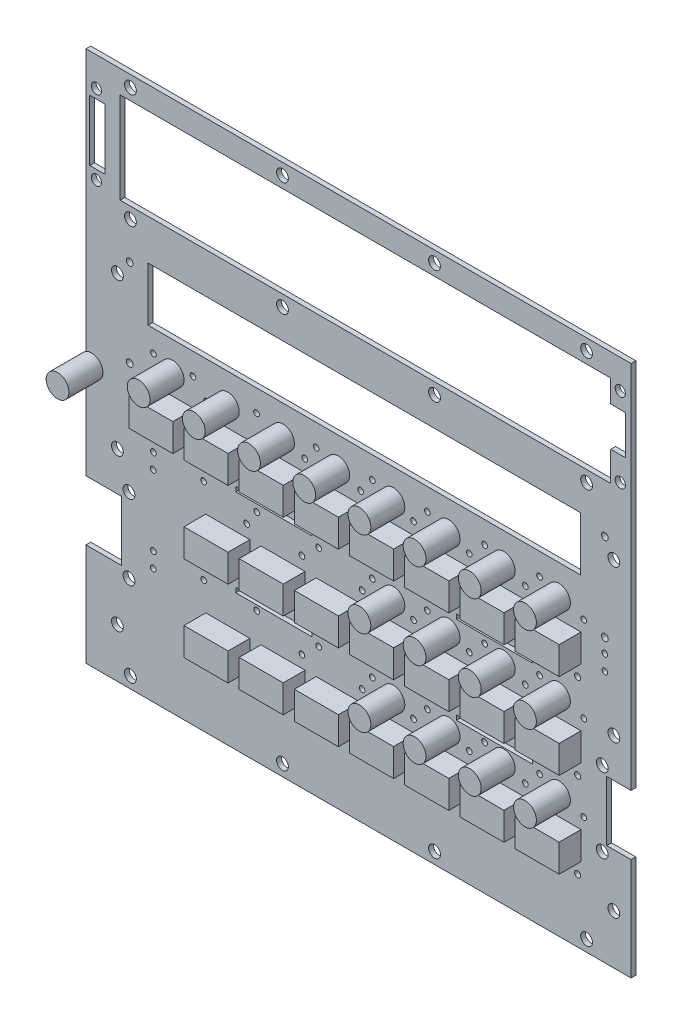
from build123d import *

# Parameters (mm, degrees)
SKETCH1_W                       = 144.56156
SKETCH1_H                       = 18.00098
SKETCH1_W_2                     = 5.08
SKETCH1_H_2                     = 20.32
SKETCH1_W_3                     = 25.4
SKETCH1_H_3                     = 1.5875
BOARD_DEPTH                     = 1.592072
SKETCH2_R                       = 3.81
LED_KINGBRIGHT_3P_2P54_1_DEPTH  = 11.3538
SKETCH3_R                       = 3.81
LED_KINGBRIGHT_3P_2P54_2_DEPTH  = 11.3538
SKETCH4_R                       = 3.81
LED_KINGBRIGHT_3P_2P54_3_DEPTH  = 11.3538
SKETCH5_R                       = 3.81
LED_KINGBRIGHT_3P_2P54_4_DEPTH  = 11.3538
SKETCH6_R                       = 3.81
LED_KINGBRIGHT_3P_2P54_5_DEPTH  = 11.3538
SKETCH7_R                       = 3.81
LED_KINGBRIGHT_3P_2P54_6_DEPTH  = 11.3538
SKETCH8_R                       = 3.81
LED_KINGBRIGHT_3P_2P54_7_DEPTH  = 11.3538
SKETCH9_R                       = 3.81
LED_KINGBRIGHT_3P_2P54_8_DEPTH  = 11.3538
SKETCH10_R                      = 3.81
LED_KINGBRIGHT_3P_2P54_9_DEPTH  = 11.3538
SKETCH19_R                      = 3.81
LED_KINGBRIGHT_3P_2P54_18_DEPTH = 11.3538
SKETCH20_R                      = 3.81
LED_KINGBRIGHT_3P_2P54_19_DEPTH = 11.3538
SKETCH21_R                      = 3.81
LED_KINGBRIGHT_3P_2P54_20_DEPTH = 11.3538
SKETCH22_R                      = 3.81
LED_KINGBRIGHT_3P_2P54_21_DEPTH = 11.3538
SKETCH23_R                      = 3.81
LED_KINGBRIGHT_3P_2P54_22_DEPTH = 11.3538
SKETCH24_R                      = 3.81
LED_KINGBRIGHT_3P_2P54_23_DEPTH = 11.3538
SKETCH25_R                      = 3.81
LED_KINGBRIGHT_3P_2P54_24_DEPTH = 11.3538
SKETCH26_R                      = 3.81
LED_KINGBRIGHT_3P_2P54_25_DEPTH = 11.3538
SKETCH27_W                      = 14.732
SKETCH27_H                      = 9.271
SWITCH_MCDTS2_1_DEPTH           = 7.3000108
SKETCH28_W                      = 14.732
SKETCH28_H                      = 9.271
SWITCH_MCDTS2_2_DEPTH           = 7.3000108
SKETCH29_W                      = 14.732
SKETCH29_H                      = 9.271
SWITCH_MCDTS2_3_DEPTH           = 7.3000108
SKETCH30_W                      = 14.732
SKETCH30_H                      = 9.271
SWITCH_MCDTS2_4_DEPTH           = 7.3000108
SKETCH31_W                      = 14.732
SKETCH31_H                      = 9.271
SWITCH_MCDTS2_5_DEPTH           = 7.3000108
SKETCH32_W                      = 14.732
SKETCH32_H                      = 9.271
SWITCH_MCDTS2_6_DEPTH           = 7.3000108
SKETCH33_W                      = 14.732
SKETCH33_H                      = 9.271
SWITCH_MCDTS2_7_DEPTH           = 7.3000108
SKETCH34_W                      = 14.732
SKETCH34_H                      = 9.271
SWITCH_MCDTS2_8_DEPTH           = 7.3000108
SKETCH36_W                      = 14.732
SKETCH36_H                      = 9.271
SWITCH_MCDTS2_10_DEPTH          = 7.3000108
SKETCH37_W                      = 14.732
SKETCH37_H                      = 9.271
SWITCH_MCDTS2_11_DEPTH          = 7.3000108
SKETCH38_W                      = 14.732
SKETCH38_H                      = 9.271
SWITCH_MCDTS2_12_DEPTH          = 7.3000108
SKETCH39_W                      = 14.732
SKETCH39_H                      = 9.271
SWITCH_MCDTS2_13_DEPTH          = 7.3000108
SKETCH40_W                      = 14.732
SKETCH40_H                      = 9.271
SWITCH_MCDTS2_14_DEPTH          = 7.3000108
SKETCH41_W                      = 14.732
SKETCH41_H                      = 9.271
SWITCH_MCDTS2_15_DEPTH          = 7.3000108
SKETCH43_W                      = 14.732
SKETCH43_H                      = 9.271
SWITCH_MCDTS2_17_DEPTH          = 7.3000108
SKETCH44_W                      = 14.732
SKETCH44_H                      = 9.271
SWITCH_MCDTS2_18_DEPTH          = 7.3000108
SKETCH45_W                      = 14.732
SKETCH45_H                      = 9.271
SWITCH_MCDTS2_19_DEPTH          = 7.3000108
SKETCH46_W                      = 14.732
SKETCH46_H                      = 9.271
SWITCH_MCDTS2_20_DEPTH          = 7.3000108
SKETCH47_W                      = 14.732
SKETCH47_H                      = 9.271
SWITCH_MCDTS2_21_DEPTH          = 7.3000108
SKETCH48_W                      = 14.732
SKETCH48_H                      = 9.271
SWITCH_MCDTS2_22_DEPTH          = 7.3000108
SKETCH49_W                      = 14.732
SKETCH49_H                      = 9.271
SWITCH_MCDTS2_23_DEPTH          = 7.3000108
SKETCH50_W                      = 14.732
SKETCH50_H                      = 9.271
SWITCH_MCDTS2_24_DEPTH          = 7.3000108
SKETCH52_R                      = 1.016
SKETCH52_R_2                    = 0.9652
SKETCH52_R_3                    = 0.9525
SKETCH52_R_4                    = 1.9685
SKETCH52_R_5                    = 1.1303
SKETCH52_R_6                    = 1.7145
CUT_EXTRUDE1_DEPTH              = 12.7


with BuildPart() as part:
    # Sketch1 → BOARD (new body)
    with BuildSketch(Plane.XY):
        Polygon((0, 0), (182.118, 0), (182.118, 34.24682), (173.98746, 34.24682), (173.98746, 54.24678), (182.118, 54.24678), (182.118, 177.8), (0, 177.8), (0, 54.24678), (11.86942, 54.24678), (11.86942, 34.24682), (0, 34.24682), align=None)
        with Locations((93.01988, 117.17909)):
            Rectangle(SKETCH1_W, SKETCH1_H, mode=Mode.SUBTRACT)
        with Locations((3.81, 154.813)):
            Rectangle(SKETCH1_W_2, SKETCH1_H_2, mode=Mode.SUBTRACT)
        Polygon((12.7, 170.18), (175.26, 170.18), (175.26, 162.6616), (180.086, 162.6616), (180.2892, 162.4584), (180.2892, 149.606), (175.3616, 149.606), (175.26, 149.5044), (175.26, 139.7), (12.7, 139.7), (11.43, 139.7), (11.43, 170.18), align=None, mode=Mode.SUBTRACT)
        with Locations((62.7634, 46.20895)):
            Rectangle(SKETCH1_W_3, SKETCH1_H_3, mode=Mode.SUBTRACT)
        with Locations((136.5134176, 46.20895)):
            Rectangle(SKETCH1_W_3, SKETCH1_H_3, mode=Mode.SUBTRACT)
        with Locations((136.5134176, 75.41895)):
            Rectangle(SKETCH1_W_3, SKETCH1_H_3, mode=Mode.SUBTRACT)
        with Locations((62.7634, 75.41895)):
            Rectangle(SKETCH1_W_3, SKETCH1_H_3, mode=Mode.SUBTRACT)
    extrude(amount=BOARD_DEPTH)

    # Sketch52 → Cut-Extrude1 (cut)
    with BuildSketch(Plane.XY.offset(1.592072)):
        with Locations((164.2745, 21.1074)):
            Circle(SKETCH52_R)
        with Locations((164.2745, 49.6824)):
            Circle(SKETCH52_R)
        with Locations((145.8341, 21.8186)):
            Circle(SKETCH52_R_2)
        with Locations((127.4191, 21.6154)):
            Circle(SKETCH52_R_2)
        with Locations((108.9787, 21.7424)):
            Circle(SKETCH52_R_2)
        with Locations((90.5383, 21.844)):
            Circle(SKETCH52_R_2)
        with Locations((72.0979, 20.7772)):
            Circle(SKETCH52_R_2)
        with Locations((53.6575, 21.1582)):
            Circle(SKETCH52_R_2)
        with Locations((35.2187002, 21.1328)):
            Circle(SKETCH52_R)
        with Locations((145.8341, 49.5554)):
            Circle(SKETCH52_R)
        with Locations((127.3937, 49.3522)):
            Circle(SKETCH52_R)
        with Locations((108.9533, 49.1236)):
            Circle(SKETCH52_R)
        with Locations((90.5129, 49.6824)):
            Circle(SKETCH52_R)
        with Locations((72.0725, 49.1998)):
            Circle(SKETCH52_R)
        with Locations((53.6321, 49.1998)):
            Circle(SKETCH52_R)
        with Locations((35.1917, 49.276)):
            Circle(SKETCH52_R)
        with Locations((164.2745, 78.2574)):
            Circle(SKETCH52_R)
        with Locations((145.8341, 77.7748)):
            Circle(SKETCH52_R)
        with Locations((127.3175, 78.3336)):
            Circle(SKETCH52_R)
        with Locations((108.9533, 78.74)):
            Circle(SKETCH52_R)
        with Locations((90.5129, 78.3336)):
            Circle(SKETCH52_R)
        with Locations((72.0725, 78.2574)):
            Circle(SKETCH52_R)
        with Locations((53.6321, 78.4098)):
            Circle(SKETCH52_R)
        with Locations((35.1917, 78.0542)):
            Circle(SKETCH52_R)
        with Locations((92.2655, 38.6588)):
            Circle(SKETCH52_R_3)
        with Locations((77.7367, 43.7388)):
            Circle(SKETCH52_R_3)
        with Locations((72.1487, 38.6588)):
            Circle(SKETCH52_R_3)
        with Locations((57.0611, 43.7388)):
            Circle(SKETCH52_R_3)
        with Locations((39.3065, 43.7388)):
            Circle(SKETCH52_R_3)
        with Locations((22.4663, 38.6588)):
            Circle(SKETCH52_R_3)
        with Locations((22.5425, 43.7388)):
            Circle(SKETCH52_R_3)
        with Locations((77.7367, 72.3138)):
            Circle(SKETCH52_R_3)
        with Locations((92.2655, 67.2338)):
            Circle(SKETCH52_R_3)
        with Locations((72.1487, 67.2338)):
            Circle(SKETCH52_R_3)
        with Locations((57.0611, 72.3138)):
            Circle(SKETCH52_R_3)
        with Locations((53.7083, 67.2338)):
            Circle(SKETCH52_R_3)
        with Locations((39.3065, 72.3138)):
            Circle(SKETCH52_R_3)
        with Locations((22.4663, 67.2338)):
            Circle(SKETCH52_R_3)
        with Locations((22.5425, 72.3138)):
            Circle(SKETCH52_R_3)
        with Locations((166.3065, 95.8088)):
            Circle(SKETCH52_R_3)
        with Locations((151.5491, 100.8888)):
            Circle(SKETCH52_R_3)
        with Locations((146.7993, 95.8088)):
            Circle(SKETCH52_R_3)
        with Locations((133.1849, 100.8888)):
            Circle(SKETCH52_R_3)
        with Locations((114.0587, 100.8888)):
            Circle(SKETCH52_R_3)
        with Locations((128.0795, 95.8088)):
            Circle(SKETCH52_R_3)
        with Locations((109.4359, 95.8088)):
            Circle(SKETCH52_R_3)
        with Locations((95.6691, 100.8888)):
            Circle(SKETCH52_R_3)
        with Locations((91.7575, 95.8088)):
            Circle(SKETCH52_R_3)
        with Locations((76.9493, 100.8888)):
            Circle(SKETCH52_R_3)
        with Locations((73.1139, 95.8088)):
            Circle(SKETCH52_R_3)
        with Locations((56.9849, 100.8888)):
            Circle(SKETCH52_R_3)
        with Locations((40.2971, 95.8088)):
            Circle(SKETCH52_R_3)
        with Locations((35.7505, 100.8888)):
            Circle(SKETCH52_R_3)
        with Locations((24.7777, 95.8088)):
            Circle(SKETCH52_R_3)
        with Locations((22.5425, 100.8888)):
            Circle(SKETCH52_R_3)
        with Locations((133.1849, 72.3138)):
            Circle(SKETCH52_R_3)
        with Locations((146.7993, 67.2338)):
            Circle(SKETCH52_R_3)
        with Locations((114.0587, 72.3138)):
            Circle(SKETCH52_R_3)
        with Locations((128.0795, 67.2338)):
            Circle(SKETCH52_R_3)
        with Locations((95.6691, 72.3138)):
            Circle(SKETCH52_R_3)
        with Locations((109.4359, 67.2338)):
            Circle(SKETCH52_R_3)
        with Locations((151.5491, 43.7388)):
            Circle(SKETCH52_R_3)
        with Locations((133.1849, 43.7388)):
            Circle(SKETCH52_R_3)
        with Locations((114.0587, 43.7388)):
            Circle(SKETCH52_R_3)
        with Locations((95.6691, 43.7388)):
            Circle(SKETCH52_R_3)
        with Locations((109.4359, 38.6588)):
            Circle(SKETCH52_R_3)
        with Locations((151.5491, 72.3138)):
            Circle(SKETCH52_R_3)
        with Locations((166.3065, 67.2338)):
            Circle(SKETCH52_R_3)
        with Locations((173.3296, 89.4588)):
            Circle(SKETCH52_R_3)
        with Locations((173.355, 84.3534)):
            Circle(SKETCH52_R_3)
        with Locations((176.37252, 118.11)):
            Circle(SKETCH52_R_4)
        with Locations((176.37252, 67.31)):
            Circle(SKETCH52_R_4)
        with Locations((176.37252, 16.51)):
            Circle(SKETCH52_R_4)
        with Locations((167.259, 135.89)):
            Circle(SKETCH52_R_4)
        with Locations((116.459, 135.89)):
            Circle(SKETCH52_R_4)
        with Locations((65.659, 135.89)):
            Circle(SKETCH52_R_4)
        with Locations((14.859, 135.89)):
            Circle(SKETCH52_R_4)
        with Locations((10.51052, 118.11)):
            Circle(SKETCH52_R_4)
        with Locations((10.51052, 67.31)):
            Circle(SKETCH52_R_4)
        with Locations((10.51052, 16.51)):
            Circle(SKETCH52_R_4)
        with Locations((166.3065, 38.6588)):
            Circle(SKETCH52_R_3)
        with Locations((146.7993, 38.6588)):
            Circle(SKETCH52_R_3)
        with Locations((128.0795, 38.6588)):
            Circle(SKETCH52_R_3)
        with Locations((14.859, 173.99)):
            Circle(SKETCH52_R_4)
        with Locations((65.659, 173.99)):
            Circle(SKETCH52_R_4)
        with Locations((116.459, 173.99)):
            Circle(SKETCH52_R_4)
        with Locations((167.259, 173.99)):
            Circle(SKETCH52_R_4)
        with Locations((167.259, 3.81)):
            Circle(SKETCH52_R_4)
        with Locations((116.459, 3.81)):
            Circle(SKETCH52_R_4)
        with Locations((65.659, 3.81)):
            Circle(SKETCH52_R_4)
        with Locations((14.859, 3.81)):
            Circle(SKETCH52_R_4)
        with Locations((172.50664, 56.7436)):
            Circle(SKETCH52_R_4)
        with Locations((172.50664, 31.75)):
            Circle(SKETCH52_R_4)
        with Locations((14.36878, 56.7436)):
            Circle(SKETCH52_R_4)
        with Locations((14.36878, 31.75)):
            Circle(SKETCH52_R_4)
        with Locations((173.35754, 123.37542)):
            Circle(SKETCH52_R_5)
        with Locations((173.35754, 94.16542)):
            Circle(SKETCH52_R_5)
        with Locations((14.60754, 94.16542)):
            Circle(SKETCH52_R_5)
        with Locations((14.60754, 123.37542)):
            Circle(SKETCH52_R_5)
        with Locations((178.51374, 141.56182)):
            Circle(SKETCH52_R_6)
        with Locations((178.51374, 168.06164)):
            Circle(SKETCH52_R_6)
        with Locations((3.50012, 168.06164)):
            Circle(SKETCH52_R_6)
        with Locations((3.50012, 141.56182)):
            Circle(SKETCH52_R_6)
    extrude(amount=-CUT_EXTRUDE1_DEPTH, mode=Mode.SUBTRACT)


with BuildPart() as body_2:
    # Sketch2 → LED-KINGBRIGHT_3P_2P54-1 (new body)
    with BuildSketch(Plane.XY.offset(1.592072)):
        with Locations((1.86944, 86.9188)):
            Circle(SKETCH2_R)
    extrude(amount=LED_KINGBRIGHT_3P_2P54_1_DEPTH)


with BuildPart() as body_3:
    # Sketch3 → LED-KINGBRIGHT_3P_2P54-2 (new body)
    with BuildSketch(Plane.XY.offset(1.592072)):
        with Locations((158.0312054, 41.1988)):
            Circle(SKETCH3_R)
    extrude(amount=LED_KINGBRIGHT_3P_2P54_2_DEPTH)


with BuildPart() as body_4:
    # Sketch4 → LED-KINGBRIGHT_3P_2P54-3 (new body)
    with BuildSketch(Plane.XY.offset(1.592072)):
        with Locations((139.593701, 41.1988)):
            Circle(SKETCH4_R)
    extrude(amount=LED_KINGBRIGHT_3P_2P54_3_DEPTH)


with BuildPart() as body_5:
    # Sketch5 → LED-KINGBRIGHT_3P_2P54-4 (new body)
    with BuildSketch(Plane.XY.offset(1.592072)):
        with Locations((121.1561966, 41.1988)):
            Circle(SKETCH5_R)
    extrude(amount=LED_KINGBRIGHT_3P_2P54_4_DEPTH)


with BuildPart() as body_6:
    # Sketch6 → LED-KINGBRIGHT_3P_2P54-5 (new body)
    with BuildSketch(Plane.XY.offset(1.592072)):
        with Locations((102.7187176, 41.1988)):
            Circle(SKETCH6_R)
    extrude(amount=LED_KINGBRIGHT_3P_2P54_5_DEPTH)


with BuildPart() as body_7:
    # Sketch7 → LED-KINGBRIGHT_3P_2P54-6 (new body)
    with BuildSketch(Plane.XY.offset(1.592072)):
        with Locations((158.0312308, 69.7738)):
            Circle(SKETCH7_R)
    extrude(amount=LED_KINGBRIGHT_3P_2P54_6_DEPTH)


with BuildPart() as body_8:
    # Sketch8 → LED-KINGBRIGHT_3P_2P54-7 (new body)
    with BuildSketch(Plane.XY.offset(1.592072)):
        with Locations((139.5937264, 69.7738)):
            Circle(SKETCH8_R)
    extrude(amount=LED_KINGBRIGHT_3P_2P54_7_DEPTH)


with BuildPart() as body_9:
    # Sketch9 → LED-KINGBRIGHT_3P_2P54-8 (new body)
    with BuildSketch(Plane.XY.offset(1.592072)):
        with Locations((121.156222, 69.7738)):
            Circle(SKETCH9_R)
    extrude(amount=LED_KINGBRIGHT_3P_2P54_8_DEPTH)


with BuildPart() as body_10:
    # Sketch10 → LED-KINGBRIGHT_3P_2P54-9 (new body)
    with BuildSketch(Plane.XY.offset(1.592072)):
        with Locations((102.7187176, 69.7738)):
            Circle(SKETCH10_R)
    extrude(amount=LED_KINGBRIGHT_3P_2P54_9_DEPTH)


with BuildPart() as body_11:
    # Sketch19 → LED-KINGBRIGHT_3P_2P54-18 (new body)
    with BuildSketch(Plane.XY.offset(1.592072)):
        with Locations((158.0312308, 98.3488)):
            Circle(SKETCH19_R)
    extrude(amount=LED_KINGBRIGHT_3P_2P54_18_DEPTH)


with BuildPart() as body_12:
    # Sketch20 → LED-KINGBRIGHT_3P_2P54-19 (new body)
    with BuildSketch(Plane.XY.offset(1.592072)):
        with Locations((139.5937264, 98.3488)):
            Circle(SKETCH20_R)
    extrude(amount=LED_KINGBRIGHT_3P_2P54_19_DEPTH)


with BuildPart() as body_13:
    # Sketch21 → LED-KINGBRIGHT_3P_2P54-20 (new body)
    with BuildSketch(Plane.XY.offset(1.592072)):
        with Locations((121.156222, 98.3488)):
            Circle(SKETCH21_R)
    extrude(amount=LED_KINGBRIGHT_3P_2P54_20_DEPTH)


with BuildPart() as body_14:
    # Sketch22 → LED-KINGBRIGHT_3P_2P54-21 (new body)
    with BuildSketch(Plane.XY.offset(1.592072)):
        with Locations((102.7187176, 98.3488)):
            Circle(SKETCH22_R)
    extrude(amount=LED_KINGBRIGHT_3P_2P54_21_DEPTH)


with BuildPart() as body_15:
    # Sketch23 → LED-KINGBRIGHT_3P_2P54-22 (new body)
    with BuildSketch(Plane.XY.offset(1.592072)):
        with Locations((84.2812132, 98.3488)):
            Circle(SKETCH23_R)
    extrude(amount=LED_KINGBRIGHT_3P_2P54_22_DEPTH)


with BuildPart() as body_16:
    # Sketch24 → LED-KINGBRIGHT_3P_2P54-23 (new body)
    with BuildSketch(Plane.XY.offset(1.592072)):
        with Locations((65.8437088, 98.3488)):
            Circle(SKETCH24_R)
    extrude(amount=LED_KINGBRIGHT_3P_2P54_23_DEPTH)


with BuildPart() as body_17:
    # Sketch25 → LED-KINGBRIGHT_3P_2P54-24 (new body)
    with BuildSketch(Plane.XY.offset(1.592072)):
        with Locations((47.4062044, 98.3488)):
            Circle(SKETCH25_R)
    extrude(amount=LED_KINGBRIGHT_3P_2P54_24_DEPTH)


with BuildPart() as body_18:
    # Sketch26 → LED-KINGBRIGHT_3P_2P54-25 (new body)
    with BuildSketch(Plane.XY.offset(1.592072)):
        with Locations((28.9687, 98.3488)):
            Circle(SKETCH26_R)
    extrude(amount=LED_KINGBRIGHT_3P_2P54_25_DEPTH)


with BuildPart() as body_19:
    # Sketch27 → SWITCH-MCDTS2-1 (new body)
    with BuildSketch(Plane.XY.offset(1.592072)):
        with Locations((158.0312308, 29.9593)):
            Rectangle(SKETCH27_W, SKETCH27_H)
    extrude(amount=SWITCH_MCDTS2_1_DEPTH)


with BuildPart() as body_20:
    # Sketch28 → SWITCH-MCDTS2-2 (new body)
    with BuildSketch(Plane.XY.offset(1.592072)):
        with Locations((158.0312308, 58.5343)):
            Rectangle(SKETCH28_W, SKETCH28_H)
    extrude(amount=SWITCH_MCDTS2_2_DEPTH)


with BuildPart() as body_21:
    # Sketch29 → SWITCH-MCDTS2-3 (new body)
    with BuildSketch(Plane.XY.offset(1.592072)):
        with Locations((139.5937264, 29.9593)):
            Rectangle(SKETCH29_W, SKETCH29_H)
    extrude(amount=SWITCH_MCDTS2_3_DEPTH)


with BuildPart() as body_22:
    # Sketch30 → SWITCH-MCDTS2-4 (new body)
    with BuildSketch(Plane.XY.offset(1.592072)):
        with Locations((121.156222, 29.9593)):
            Rectangle(SKETCH30_W, SKETCH30_H)
    extrude(amount=SWITCH_MCDTS2_4_DEPTH)


with BuildPart() as body_23:
    # Sketch31 → SWITCH-MCDTS2-5 (new body)
    with BuildSketch(Plane.XY.offset(1.592072)):
        with Locations((102.7187176, 29.9593)):
            Rectangle(SKETCH31_W, SKETCH31_H)
    extrude(amount=SWITCH_MCDTS2_5_DEPTH)


with BuildPart() as body_24:
    # Sketch32 → SWITCH-MCDTS2-6 (new body)
    with BuildSketch(Plane.XY.offset(1.592072)):
        with Locations((84.2812132, 29.9593)):
            Rectangle(SKETCH32_W, SKETCH32_H)
    extrude(amount=SWITCH_MCDTS2_6_DEPTH)


with BuildPart() as body_25:
    # Sketch33 → SWITCH-MCDTS2-7 (new body)
    with BuildSketch(Plane.XY.offset(1.592072)):
        with Locations((65.8437088, 29.9593)):
            Rectangle(SKETCH33_W, SKETCH33_H)
    extrude(amount=SWITCH_MCDTS2_7_DEPTH)


with BuildPart() as body_26:
    # Sketch34 → SWITCH-MCDTS2-8 (new body)
    with BuildSketch(Plane.XY.offset(1.592072)):
        with Locations((47.4062044, 29.9593)):
            Rectangle(SKETCH34_W, SKETCH34_H)
    extrude(amount=SWITCH_MCDTS2_8_DEPTH)


with BuildPart() as body_27:
    # Sketch36 → SWITCH-MCDTS2-10 (new body)
    with BuildSketch(Plane.XY.offset(1.592072)):
        with Locations((139.5937264, 58.5343)):
            Rectangle(SKETCH36_W, SKETCH36_H)
    extrude(amount=SWITCH_MCDTS2_10_DEPTH)


with BuildPart() as body_28:
    # Sketch37 → SWITCH-MCDTS2-11 (new body)
    with BuildSketch(Plane.XY.offset(1.592072)):
        with Locations((121.156222, 58.5343)):
            Rectangle(SKETCH37_W, SKETCH37_H)
    extrude(amount=SWITCH_MCDTS2_11_DEPTH)


with BuildPart() as body_29:
    # Sketch38 → SWITCH-MCDTS2-12 (new body)
    with BuildSketch(Plane.XY.offset(1.592072)):
        with Locations((102.7187176, 58.5343)):
            Rectangle(SKETCH38_W, SKETCH38_H)
    extrude(amount=SWITCH_MCDTS2_12_DEPTH)


with BuildPart() as body_30:
    # Sketch39 → SWITCH-MCDTS2-13 (new body)
    with BuildSketch(Plane.XY.offset(1.592072)):
        with Locations((84.2812132, 58.5343)):
            Rectangle(SKETCH39_W, SKETCH39_H)
    extrude(amount=SWITCH_MCDTS2_13_DEPTH)


with BuildPart() as body_31:
    # Sketch40 → SWITCH-MCDTS2-14 (new body)
    with BuildSketch(Plane.XY.offset(1.592072)):
        with Locations((65.8437088, 58.5343)):
            Rectangle(SKETCH40_W, SKETCH40_H)
    extrude(amount=SWITCH_MCDTS2_14_DEPTH)


with BuildPart() as body_32:
    # Sketch41 → SWITCH-MCDTS2-15 (new body)
    with BuildSketch(Plane.XY.offset(1.592072)):
        with Locations((47.4062044, 58.5343)):
            Rectangle(SKETCH41_W, SKETCH41_H)
    extrude(amount=SWITCH_MCDTS2_15_DEPTH)


with BuildPart() as body_33:
    # Sketch43 → SWITCH-MCDTS2-17 (new body)
    with BuildSketch(Plane.XY.offset(1.592072)):
        with Locations((158.0312308, 87.1093)):
            Rectangle(SKETCH43_W, SKETCH43_H)
    extrude(amount=SWITCH_MCDTS2_17_DEPTH)


with BuildPart() as body_34:
    # Sketch44 → SWITCH-MCDTS2-18 (new body)
    with BuildSketch(Plane.XY.offset(1.592072)):
        with Locations((139.5937264, 87.1093)):
            Rectangle(SKETCH44_W, SKETCH44_H)
    extrude(amount=SWITCH_MCDTS2_18_DEPTH)


with BuildPart() as body_35:
    # Sketch45 → SWITCH-MCDTS2-19 (new body)
    with BuildSketch(Plane.XY.offset(1.592072)):
        with Locations((121.156222, 87.1093)):
            Rectangle(SKETCH45_W, SKETCH45_H)
    extrude(amount=SWITCH_MCDTS2_19_DEPTH)


with BuildPart() as body_36:
    # Sketch46 → SWITCH-MCDTS2-20 (new body)
    with BuildSketch(Plane.XY.offset(1.592072)):
        with Locations((102.7187176, 87.1093)):
            Rectangle(SKETCH46_W, SKETCH46_H)
    extrude(amount=SWITCH_MCDTS2_20_DEPTH)


with BuildPart() as body_37:
    # Sketch47 → SWITCH-MCDTS2-21 (new body)
    with BuildSketch(Plane.XY.offset(1.592072)):
        with Locations((84.2812132, 87.1093)):
            Rectangle(SKETCH47_W, SKETCH47_H)
    extrude(amount=SWITCH_MCDTS2_21_DEPTH)


with BuildPart() as body_38:
    # Sketch48 → SWITCH-MCDTS2-22 (new body)
    with BuildSketch(Plane.XY.offset(1.592072)):
        with Locations((65.8437088, 87.1093)):
            Rectangle(SKETCH48_W, SKETCH48_H)
    extrude(amount=SWITCH_MCDTS2_22_DEPTH)


with BuildPart() as body_39:
    # Sketch49 → SWITCH-MCDTS2-23 (new body)
    with BuildSketch(Plane.XY.offset(1.592072)):
        with Locations((47.4062044, 87.1093)):
            Rectangle(SKETCH49_W, SKETCH49_H)
    extrude(amount=SWITCH_MCDTS2_23_DEPTH)


with BuildPart() as body_40:
    # Sketch50 → SWITCH-MCDTS2-24 (new body)
    with BuildSketch(Plane.XY.offset(1.592072)):
        with Locations((28.9687, 87.1093)):
            Rectangle(SKETCH50_W, SKETCH50_H)
    extrude(amount=SWITCH_MCDTS2_24_DEPTH)


solid = Compound([part.part, body_2.part, body_3.part, body_4.part, body_5.part, body_6.part, body_7.part, body_8.part, body_9.part, body_10.part, body_11.part, body_12.part, body_13.part, body_14.part, body_15.part, body_16.part, body_17.part, body_18.part, body_19.part, body_20.part, body_21.part, body_22.part, body_23.part, body_24.part, body_25.part, body_26.part, body_27.part, body_28.part, body_29.part, body_30.part, body_31.part, body_32.part, body_33.part, body_34.part, body_35.part, body_36.part, body_37.part, body_38.part, body_39.part, body_40.part])
